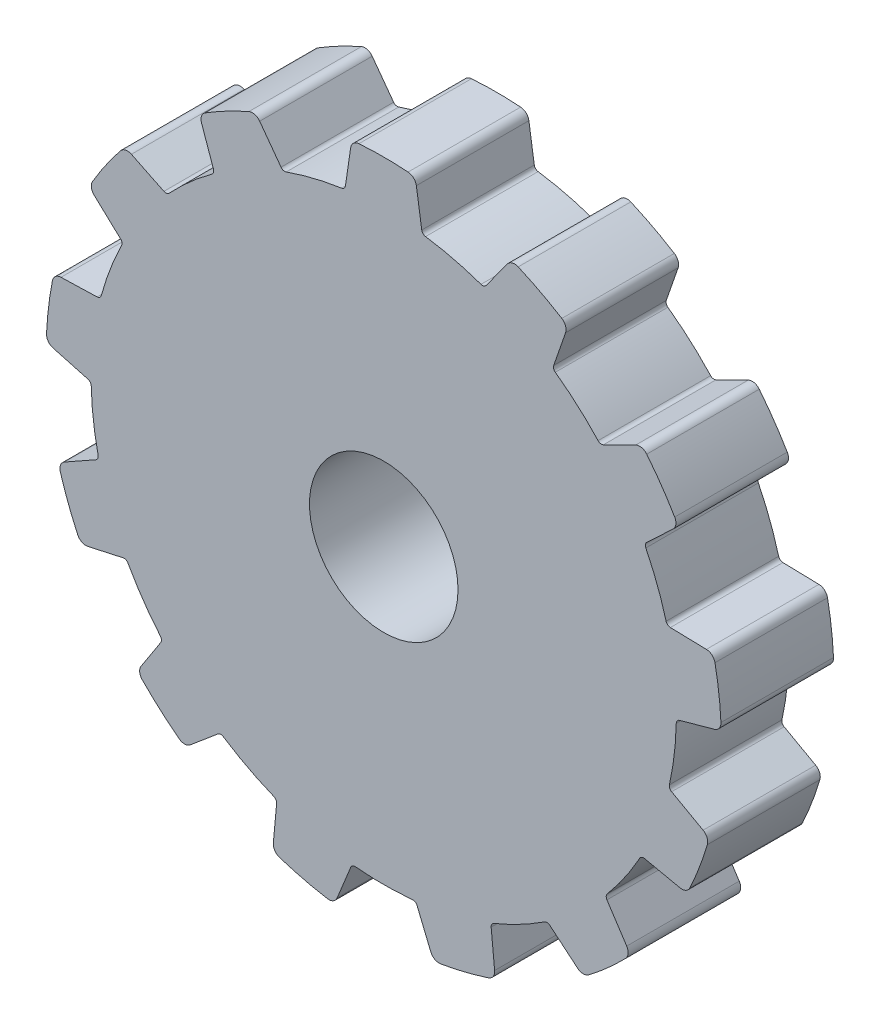
from build123d import *

# Parameters (mm, degrees)
RESSALTO_EXTRUS_O1_DEPTH = 2.5
ESBO_O2_R                = 1.65
CORTE_EXTRUS_O1_DEPTH    = 11.891664024


with BuildPart() as part:
    # Esboço1 → Ressalto-extrusão1 (new body)
    with BuildSketch(Plane.XY):
        with BuildLine():
            Line((2.274601503, 6.165929395), (2.745743779, 6.813655149))
            ThreePointArc((2.745743779, 6.813655149), (2.854880588, 6.888968105), (2.987139863, 6.879461857))
            ThreePointArc((2.987139863, 6.879461857), (3.480600792, 6.643449264), (3.955547671, 6.372098761))
            ThreePointArc((3.955547671, 6.372098761), (4.038558016, 6.269040995), (4.03904852, 6.136710424))
            Line((4.03904852, 6.136710424), (3.776369648, 5.378426201))
            ThreePointArc((3.776369648, 5.378426201), (3.775484994, 5.315635516), (3.812211303, 5.264697995))
            ThreePointArc((3.812211303, 5.264697995), (4.307643395, 4.867669707), (4.76197859, 4.424201613))
            ThreePointArc((4.76197859, 4.424201613), (4.817162567, 4.393913756), (4.879509874, 4.402599311))
            Line((4.879509874, 4.402599311), (5.597698808, 4.75718125))
            ThreePointArc((5.597698808, 4.75718125), (5.729334329, 4.773149156), (5.842026327, 4.703267842))
            ThreePointArc((5.842026327, 4.703267842), (6.16928376, 4.264966341), (6.463725469, 3.803978583))
            ThreePointArc((6.463725469, 3.803978583), (6.489334147, 3.674148632), (6.428271384, 3.556747783))
            Line((6.428271384, 3.556747783), (5.843288544, 3.007393407))
            ThreePointArc((5.843288544, 3.007393407), (5.813324936, 2.952206135), (5.822172622, 2.890035634))
            ThreePointArc((5.822172622, 2.890035634), (6.076347708, 2.308245771), (6.272551644, 1.704434182))
            ThreePointArc((6.272551644, 1.704434182), (6.30733916, 1.651970343), (6.366581337, 1.630686782))
            Line((6.366581337, 1.630686782), (7.1672885, 1.610894457))
            ThreePointArc((7.1672885, 1.610894457), (7.291266621, 1.563859258), (7.358574964, 1.449611845))
            ThreePointArc((7.358574964, 1.449611845), (7.444658166, 0.909431028), (7.491141658, 0.364412755))
            ThreePointArc((7.491141658, 0.364412755), (7.45348203, 0.237553096), (7.344854743, 0.161977088))
            Line((7.344854743, 0.161977088), (6.571580455, -0.052596974))
            ThreePointArc((6.571580455, -0.052596974), (6.519402194, -0.087538093), (6.498344357, -0.146699062))
            ThreePointArc((6.498344357, -0.146699062), (6.453033988, -0.779969455), (6.346158708, -1.40579858))
            ThreePointArc((6.346158708, -1.40579858), (6.352580363, -1.468419567), (6.395145742, -1.514796437))
            Line((6.395145742, -1.514796437), (7.094938772, -1.904428843))
            ThreePointArc((7.094938772, -1.904428843), (7.182857599, -2.003691949), (7.189362757, -2.136132756))
            ThreePointArc((7.189362757, -2.136132756), (7.014551104, -2.654443974), (6.802427572, -3.158635644))
            ThreePointArc((6.802427572, -3.158635644), (6.710127004, -3.253462991), (6.578820396, -3.269900606))
            Line((6.578820396, -3.269900606), (5.794402479, -3.100538022))
            ThreePointArc((5.794402479, -3.100538022), (5.731962976, -3.1072284), (5.685823714, -3.149826772))
            ThreePointArc((5.685823714, -3.149826772), (5.351407949, -3.689503078), (4.965937293, -4.193979829))
            ThreePointArc((4.965937293, -4.193979829), (4.942521962, -4.25241225), (4.958659327, -4.313258047))
            Line((4.958659327, -4.313258047), (5.397224074, -4.983470446))
            ThreePointArc((5.397224074, -4.983470446), (5.428942465, -5.112221478), (5.373154184, -5.232515085))
            ThreePointArc((5.373154184, -5.232515085), (4.977494919, -5.610217851), (4.555359307, -5.958078683))
            ThreePointArc((4.555359307, -5.958078683), (4.429562747, -5.999149916), (4.305657579, -5.952683478))
            Line((4.305657579, -5.952683478), (3.689796725, -5.438183174))
            ThreePointArc((3.689796725, -5.438183174), (3.631400117, -5.415090125), (3.57074938, -5.431367127))
            ThreePointArc((3.57074938, -5.431367127), (3.023838841, -5.753816009), (2.448079489, -6.021370842))
            ThreePointArc((2.448079489, -6.021370842), (2.400191343, -6.062228535), (2.386203819, -6.12360422))
            Line((2.386203819, -6.12360422), (2.463070385, -6.920859027))
            ThreePointArc((2.463070385, -6.920859027), (2.431322037, -7.049602675), (2.32602074, -7.130191268))
            ThreePointArc((2.32602074, -7.130191268), (1.800154633, -7.280758429), (1.264713122, -7.392597698))
            ThreePointArc((1.264713122, -7.392597698), (1.134239047, -7.370503893), (1.0461205, -7.271778302))
            Line((1.0461205, -7.271778302), (0.739903009, -6.530006099))
            ThreePointArc((0.739903009, -6.530006099), (0.698927256, -6.482419963), (0.637659395, -6.468646728))
            ThreePointArc((0.637659395, -6.468646728), (0.003544695, -6.499999033), (-0.630603823, -6.46933836))
            ThreePointArc((-0.630603823, -6.46933836), (-0.691994187, -6.483261319), (-0.732902228, -6.531106463))
            Line((-0.732902228, -6.531106463), (-1.035343047, -7.27276221))
            ThreePointArc((-1.035343047, -7.27276221), (-1.123284969, -7.372004856), (-1.253976023, -7.394426559))
            ThreePointArc((-1.253976023, -7.394426559), (-1.789579385, -7.283364993), (-2.315663597, -7.133561671))
            ThreePointArc((-2.315663597, -7.133561671), (-2.42092515, -7.053364252), (-2.453070179, -6.924996352))
            Line((-2.453070179, -6.924996352), (-2.37949357, -6.125883321))
            ThreePointArc((-2.37949357, -6.125883321), (-2.393661418, -6.064705508), (-2.441510673, -6.02403732))
            ThreePointArc((-2.441510673, -6.02403732), (-3.017561497, -5.757110613), (-3.564823398, -5.435258424))
            ThreePointArc((-3.564823398, -5.435258424), (-3.625652188, -5.419057068), (-3.684109206, -5.442410924))
            Line((-3.684109206, -5.442410924), (-4.296571863, -5.958563217))
            ThreePointArc((-4.296571863, -5.958563217), (-4.420560925, -6.005569567), (-4.546701991, -5.964687838))
            ThreePointArc((-4.546701991, -5.964687838), (-4.969342333, -5.617440412), (-5.365549693, -5.240312634))
            ThreePointArc((-5.365549693, -5.240312634), (-5.42148457, -5.120383863), (-5.390292042, -4.991781193))
            Line((-5.390292042, -4.991781193), (-4.953776848, -4.318394499))
            ThreePointArc((-4.953776848, -4.318394499), (-4.937891107, -4.257640109), (-4.961360069, -4.199393559))
            ThreePointArc((-4.961360069, -4.199393559), (-5.347380717, -3.695337532), (-5.682384894, -3.156026285))
            ThreePointArc((-5.682384894, -3.156026285), (-5.728716967, -3.113412148), (-5.791331164, -3.10692463))
            Line((-5.791331164, -3.10692463), (-6.573507845, -3.2793292))
            ThreePointArc((-6.573507845, -3.2793292), (-6.705139647, -3.263330665), (-6.797833327, -3.168511015))
            ThreePointArc((-6.797833327, -3.168511015), (-7.010688839, -2.664627929), (-7.186253016, -2.146571125))
            ThreePointArc((-7.186253016, -2.146571125), (-7.180047212, -2.014385238), (-7.092662959, -1.91500912))
            Line((-7.092662959, -1.91500912), (-6.39320955, -1.52161354))
            ThreePointArc((-6.39320955, -1.52161354), (-6.350909451, -1.475200671), (-6.344621664, -1.412719342))
            ThreePointArc((-6.344621664, -1.412719342), (-6.452179456, -0.787007155), (-6.498180491, -0.153786559))
            ThreePointArc((-6.498180491, -0.153786559), (-6.519401727, -0.094522027), (-6.571828945, -0.059679346))
            Line((-6.571828945, -0.059679346), (-7.344532399, 0.151159617))
            ThreePointArc((-7.344532399, 0.151159617), (-7.453651682, 0.226497964), (-7.491662971, 0.353533496))
            ThreePointArc((-7.491662971, 0.353533496), (-7.44597102, 0.898618699), (-7.360672377, 1.43892396))
            ThreePointArc((-7.360672377, 1.43892396), (-7.293747566, 1.553084768), (-7.170190267, 1.600468464))
            Line((-7.170190267, 1.600468464), (-6.36803499, 1.623750744))
            ThreePointArc((-6.36803499, 1.623750744), (-6.309010977, 1.645189462), (-6.274406897, 1.697591851))
            ThreePointArc((-6.274406897, 1.697591851), (-6.07886164, 2.301617076), (-5.825321249, 2.883683815))
            ThreePointArc((-5.825321249, 2.883683815), (-5.816570119, 2.946021952), (-5.846799914, 3.001237757))
            Line((-5.846799914, 3.001237757), (-6.433013092, 3.547019587))
            ThreePointArc((-6.433013092, 3.547019587), (-6.494621942, 3.66443864), (-6.469242912, 3.794587744))
            ThreePointArc((-6.469242912, 3.794587744), (-6.175470974, 4.256002613), (-5.848850402, 4.694778906))
            ThreePointArc((-5.848850402, 4.694778906), (-5.736538252, 4.764761771), (-5.605113396, 4.749298011))
            Line((-5.605113396, 4.749298011), (-4.884020357, 4.3971333))
            ThreePointArc((-4.884020357, 4.3971333), (-4.82179412, 4.388686517), (-4.766801124, 4.419005209))
            ThreePointArc((-4.766801124, 4.419005209), (-4.31294988, 4.862968572), (-3.817951111, 5.260536979))
            ThreePointArc((-3.817951111, 5.260536979), (-3.781232394, 5.311667805), (-3.782339484, 5.374607458))
            Line((-3.782339484, 5.374607458), (-4.047768011, 6.130300117))
            ThreePointArc((-4.047768011, 6.130300117), (-4.047752584, 6.262900585), (-3.964797265, 6.36634767))
            ThreePointArc((-3.964797265, 6.36634767), (-3.490244951, 6.638387619), (-2.997127286, 6.875116583))
            ThreePointArc((-2.997127286, 6.875116583), (-2.865157157, 6.884889274), (-2.755972594, 6.810120618))
            Line((-2.755972594, 6.810120618), (-2.28113552, 6.163185609))
            ThreePointArc((-2.28113552, 6.163185609), (-2.229962339, 6.126788379), (-2.167178661, 6.128077729))
            ThreePointArc((-2.167178661, 6.128077729), (-1.558993279, 6.310272574), (-0.935934386, 6.432264518))
            ThreePointArc((-0.935934386, 6.432264518), (-0.879659896, 6.460474577), (-0.851390661, 6.516719362))
            Line((-0.851390661, 6.516719362), (-0.73522806, 7.309202767))
            ThreePointArc((-0.73522806, 7.309202767), (-0.67359189, 7.426607482), (-0.552064345, 7.479654067))
            ThreePointArc((-0.552064345, 7.479654067), (-0.005445871, 7.499998023), (0.541201571, 7.480447905))
            ThreePointArc((0.541201571, 7.480447905), (0.662596914, 7.427771616), (0.724528315, 7.310826663))
            Line((0.724528315, 7.310826663), (0.844329975, 6.517326369))
            ThreePointArc((0.844329975, 6.517326369), (0.87272694, 6.46131686), (0.928918317, 6.433281492))
            ThreePointArc((0.928918317, 6.433281492), (1.552109894, 6.311969176), (2.160493629, 6.130437772))
            ThreePointArc((2.160493629, 6.130437772), (2.223432083, 6.12926448), (2.274601503, 6.165929395))
        make_face()
    extrude(amount=RESSALTO_EXTRUS_O1_DEPTH)

    # Esboço2 → Corte-extrusão1 (cut, through all)
    with BuildSketch(Plane.XY.offset(2.5)):
        Circle(ESBO_O2_R)
    extrude(amount=-CORTE_EXTRUS_O1_DEPTH, mode=Mode.SUBTRACT)


solid = part.part
